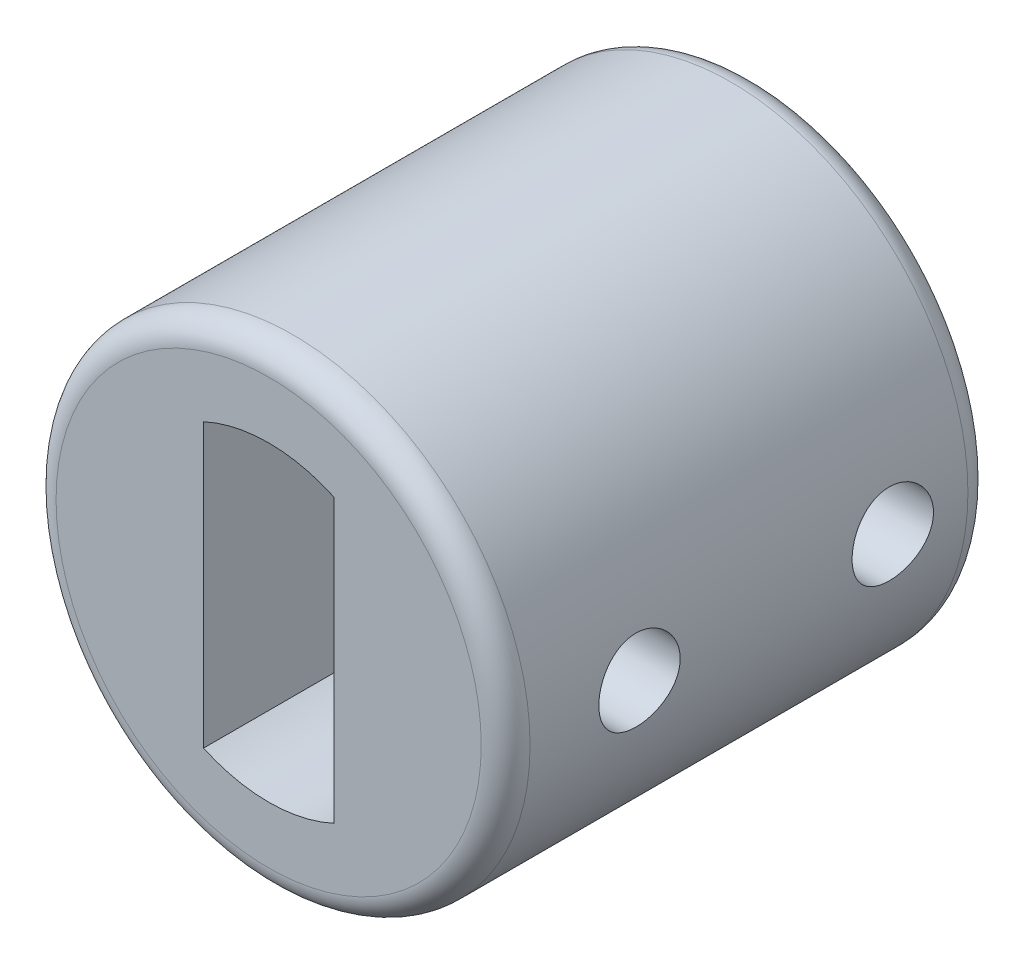
from build123d import *

# Parameters (mm, degrees)
SKETCH1_R             = 7.28
BOSS_EXTRUDE1_DEPTH   = 7.475
CUT_EXTRUDE1_DEPTH    = 8.04
CUT_EXTRUDE2_DEPTH    = 5
CHAMFER2_SIZE         = 0.3
CHAMFER4_SIZE         = 0.3
FILLET1_R             = 0.75
FILLET2_R             = 0.6
FILLET3_R             = 0.3
M3_TAPPED_HOLE3_D     = 2.5
M3_TAPPED_HOLE3_DEPTH = 6
M3_TAPPED_HOLE3_TIP   = 0.751075774
M3_TAPPED_HOLE4_D     = 2.5
M3_TAPPED_HOLE4_DEPTH = 6.5
M3_TAPPED_HOLE4_TIP   = 0.751075774


with BuildPart() as part:
    # Sketch1 → Boss-Extrude1 (new, symmetric)
    with BuildSketch(Plane.XY):
        Circle(SKETCH1_R)
    extrude(amount=BOSS_EXTRUDE1_DEPTH, both=True)

    # Sketch3 → Cut-Extrude1 (cut)
    with BuildSketch(Plane.XY.offset(7.475)):
        with BuildLine():
            ThreePointArc((2, 4.341474404), (0, 4.78), (-2, 4.341474404))
            Line((-2, 4.341474404), (-2, -4.341474404))
            ThreePointArc((-2, -4.341474404), (0, -4.78), (2, -4.341474404))
            Line((2, -4.341474404), (2, 4.341474404))
        make_face()
    extrude(amount=-CUT_EXTRUDE1_DEPTH, mode=Mode.SUBTRACT)

    # Sketch4 → Cut-Extrude2 (cut)
    with BuildSketch(Plane(origin=(0, 0, -7.475), x_dir=(-1, 0, 0), z_dir=(0, 0, -1))):
        with BuildLine():
            Line((-1.5, 1.974943037), (-1.5, -1.974943037))
            ThreePointArc((-1.5, -1.974943037), (0, -2.48), (1.5, -1.974943037))
            Line((1.5, -1.974943037), (1.5, 1.974943037))
            ThreePointArc((1.5, 1.974943037), (0, 2.48), (-1.5, 1.974943037))
        make_face()
    extrude(amount=-CUT_EXTRUDE2_DEPTH, mode=Mode.SUBTRACT)

    # Chamfer2
    chamfer2_edges = [part.edges().sort_by_distance(p)[0] for p in [
        (-1.5, 0, -2.475),
        (1.5, 0, -2.475),
    ]]
    chamfer(chamfer2_edges, length=CHAMFER2_SIZE)

    # Chamfer4
    chamfer4_edges = [part.edges().sort_by_distance(p)[0] for p in [
        (0, -2.48, -7.475),
        (-1.5, 0, -7.475),
        (0, 2.48, -7.475),
        (1.5, 0, -7.475),
    ]]
    chamfer(chamfer4_edges, length=CHAMFER4_SIZE)

    # Fillet1
    fillet1_edges = [part.edges().sort_by_distance(p)[0] for p in [
        (-7.28, 0, 7.475),
        (-7.28, 0, -7.475),
    ]]
    fillet(fillet1_edges, radius=FILLET1_R)

    # Fillet2
    fillet2_edges = [part.edges().sort_by_distance(p)[0] for p in [
        (0, -4.78, -0.565),
        (0, 4.78, -0.565),
    ]]
    fillet(fillet2_edges, radius=FILLET2_R)

    # Fillet3
    fillet3_edges = [part.edges().sort_by_distance(p)[0] for p in [
        (0, 2.48, -2.475),
        (0, -2.48, -2.475),
    ]]
    fillet(fillet3_edges, radius=FILLET3_R)

    # M3 Tapped Hole3
    with Locations(Plane(origin=(7.28, 0, 0), x_dir=(0, 0, -1), z_dir=(1, 0, 0))):
        with Locations((-3.3625, 0)):
            Hole(M3_TAPPED_HOLE3_D / 2, depth=M3_TAPPED_HOLE3_DEPTH)
            with Locations((0, 0, -(M3_TAPPED_HOLE3_DEPTH + M3_TAPPED_HOLE3_TIP / 2))):  # 118° drill point
                Cone(0, M3_TAPPED_HOLE3_D / 2, M3_TAPPED_HOLE3_TIP, mode=Mode.SUBTRACT)

    # M3 Tapped Hole4
    with Locations(Plane(origin=(7.28, 0, 0), x_dir=(0, 0, -1), z_dir=(1, 0, 0))):
        with Locations((4.41685425, 0)):
            Hole(M3_TAPPED_HOLE4_D / 2, depth=M3_TAPPED_HOLE4_DEPTH)
            with Locations((0, 0, -(M3_TAPPED_HOLE4_DEPTH + M3_TAPPED_HOLE4_TIP / 2))):  # 118° drill point
                Cone(0, M3_TAPPED_HOLE4_D / 2, M3_TAPPED_HOLE4_TIP, mode=Mode.SUBTRACT)


solid = part.part
